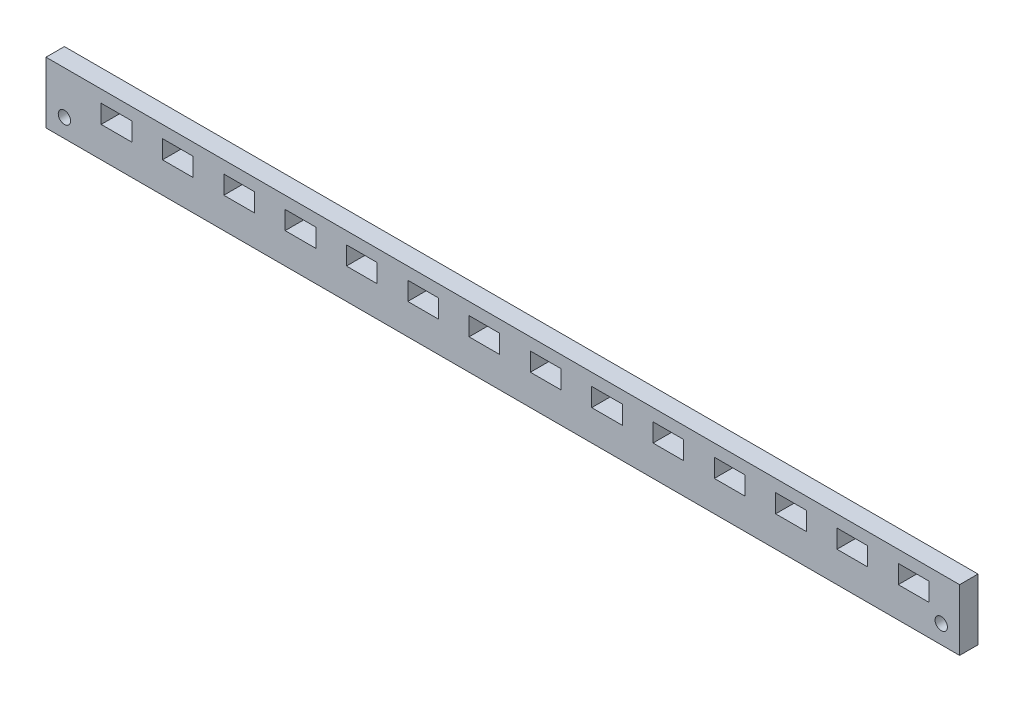
from build123d import *

# Parameters (mm, degrees)
ESQUISSE1_W             = 149
ESQUISSE1_H             = 10
BOSS_EXTRU_1_DEPTH      = 3
ESQUISSE2_R             = 1.005
ESQUISSE2_W             = 5
ESQUISSE2_H             = 3
ENL_V_MAT_EXTRU_1_DEPTH = 150.365323954


with BuildPart() as part:
    # Esquisse1 → Boss.-Extru.1 (new body)
    with BuildSketch(Plane.XY):
        with Locations((74.5, 5)):
            Rectangle(ESQUISSE1_W, ESQUISSE1_H)
    extrude(amount=BOSS_EXTRU_1_DEPTH)

    # Esquisse2 → Enlèv. mat.-Extru.1 (cut, through all)
    with BuildSketch(Plane(origin=(0, 0, 0), x_dir=(-1, 0, 0), z_dir=(0, 0, -1))):
        with Locations((-3, 3)):
            Circle(ESQUISSE2_R)
        with Locations((-146, 3)):
            Circle(ESQUISSE2_R)
        with Locations((-141.5, 6.5)):
            Rectangle(ESQUISSE2_W, ESQUISSE2_H)
        with Locations((-131.5, 6.5)):
            Rectangle(ESQUISSE2_W, ESQUISSE2_H)
        with Locations((-121.5, 6.5)):
            Rectangle(ESQUISSE2_W, ESQUISSE2_H)
        with Locations((-111.5, 6.5)):
            Rectangle(ESQUISSE2_W, ESQUISSE2_H)
        with Locations((-101.5, 6.5)):
            Rectangle(ESQUISSE2_W, ESQUISSE2_H)
        with Locations((-91.5, 6.5)):
            Rectangle(ESQUISSE2_W, ESQUISSE2_H)
        with Locations((-81.5, 6.5)):
            Rectangle(ESQUISSE2_W, ESQUISSE2_H)
        with Locations((-71.5, 6.5)):
            Rectangle(ESQUISSE2_W, ESQUISSE2_H)
        with Locations((-61.5, 6.5)):
            Rectangle(ESQUISSE2_W, ESQUISSE2_H)
        with Locations((-51.5, 6.5)):
            Rectangle(ESQUISSE2_W, ESQUISSE2_H)
        with Locations((-41.5, 6.5)):
            Rectangle(ESQUISSE2_W, ESQUISSE2_H)
        with Locations((-31.5, 6.5)):
            Rectangle(ESQUISSE2_W, ESQUISSE2_H)
        with Locations((-21.5, 6.5)):
            Rectangle(ESQUISSE2_W, ESQUISSE2_H)
        with Locations((-11.5, 6.5)):
            Rectangle(ESQUISSE2_W, ESQUISSE2_H)
    extrude(amount=-ENL_V_MAT_EXTRU_1_DEPTH, mode=Mode.SUBTRACT)


solid = part.part
